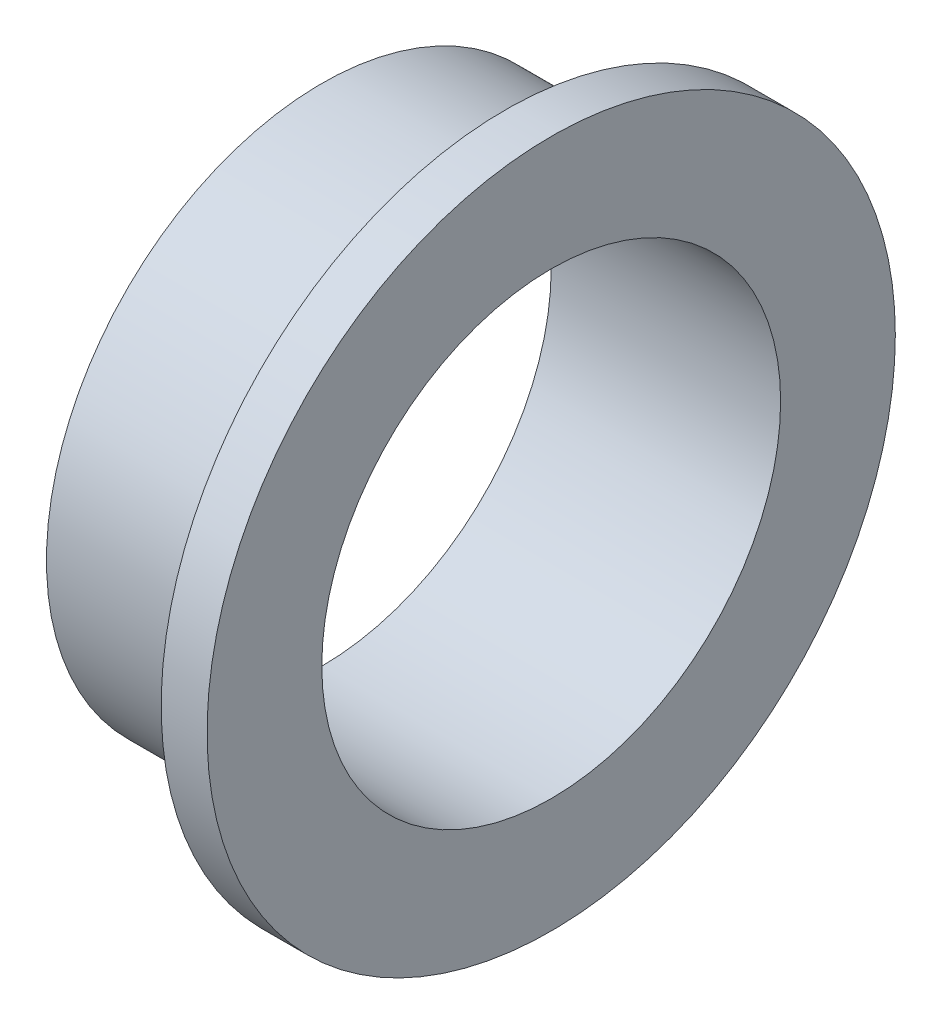
from build123d import *

# Parameters (mm, degrees)
SKETCH2_R           = 7.5
SKETCH2_R_2         = 6
BOSS_EXTRUDE1_DEPTH = 1
SKETCH2_3_R         = 6
SKETCH2_3_R_2       = 5
BOSS_EXTRUDE2_DEPTH = 5


with BuildPart() as part:
    # Sketch2 → Boss-Extrude1 (new body)
    with BuildSketch(Plane.YZ):
        Circle(SKETCH2_R)
        Circle(SKETCH2_R_2, mode=Mode.SUBTRACT)
    extrude(amount=-BOSS_EXTRUDE1_DEPTH)

    # Sketch2<3> → Boss-Extrude2 (add)
    with BuildSketch(Plane.YZ):
        Circle(SKETCH2_3_R)
        Circle(SKETCH2_3_R_2, mode=Mode.SUBTRACT)
    extrude(amount=-BOSS_EXTRUDE2_DEPTH)


solid = part.part
